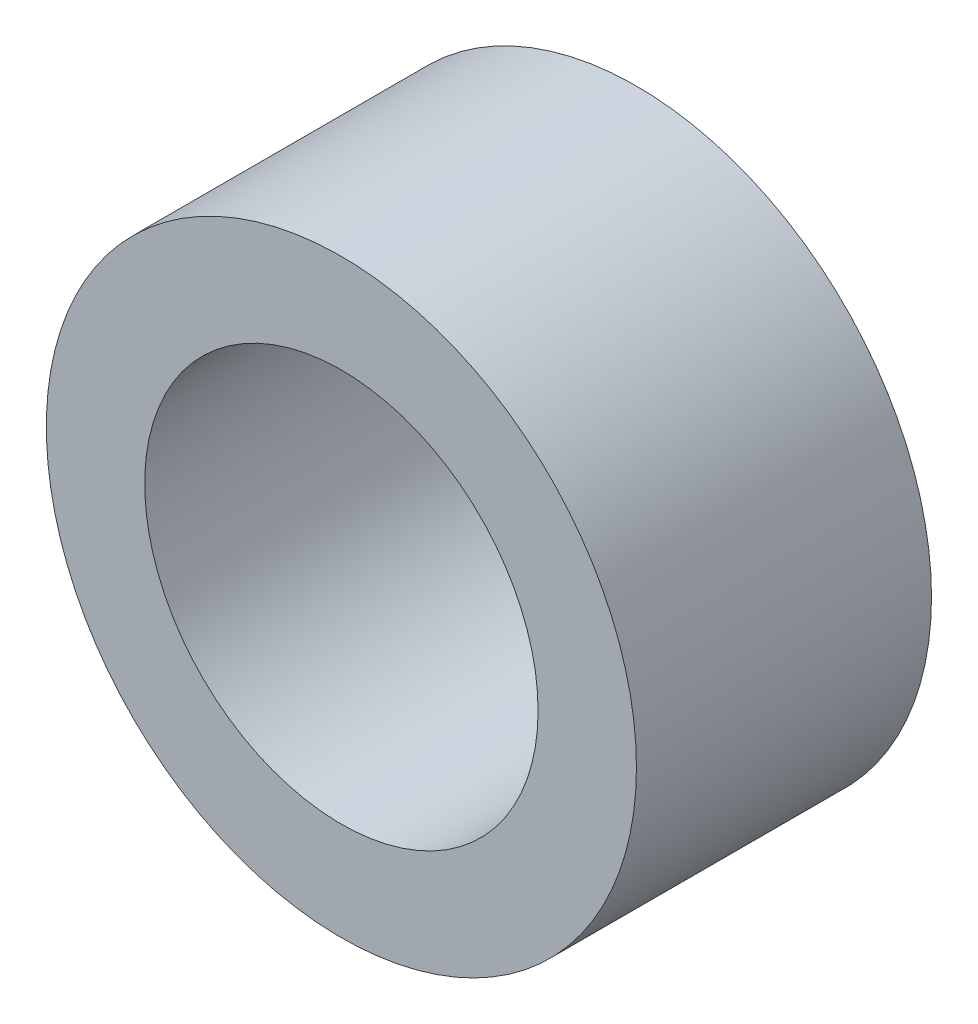
from build123d import *

# Parameters (mm, degrees)
SKETCH_1_R      = 3
SKETCH_1_R_2    = 2
EXTRUDE_1_DEPTH = 3


with BuildPart() as part:
    # 草图1 → 凸台-拉伸1 (new body)
    with BuildSketch(Plane.XY):
        Circle(SKETCH_1_R)
        Circle(SKETCH_1_R_2, mode=Mode.SUBTRACT)
    extrude(amount=EXTRUDE_1_DEPTH)


solid = part.part
